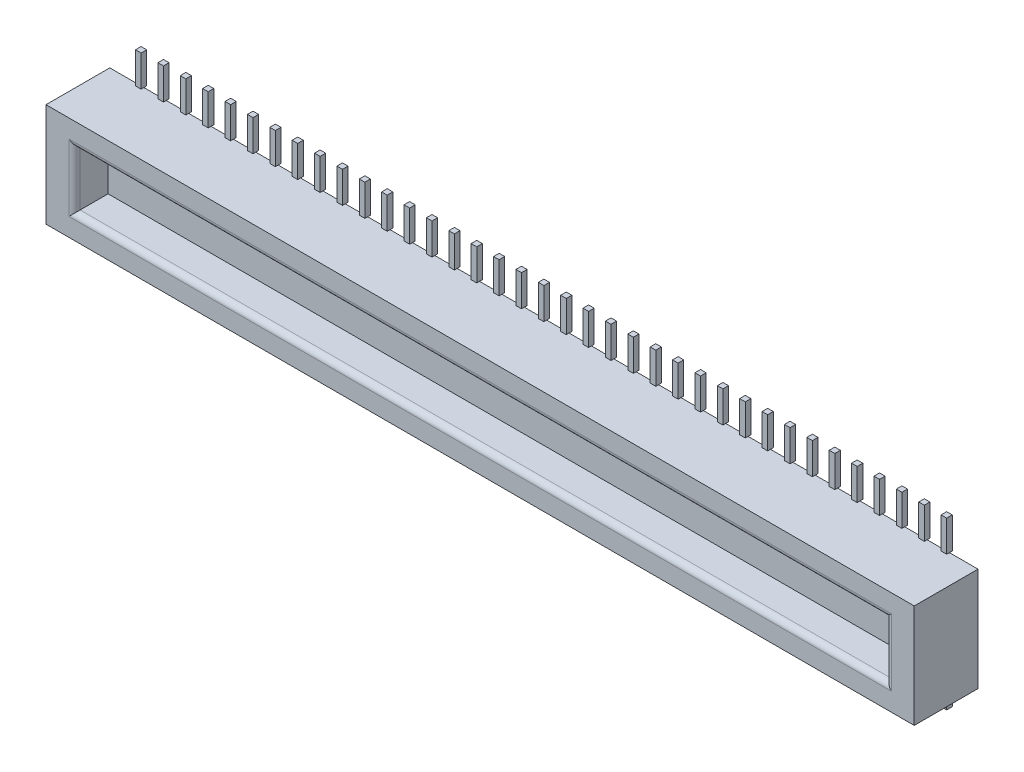
from build123d import *

# Parameters (mm, degrees)
SKETCH1_W                = 15.52
SKETCH1_H                = 1.85
BOSS_EXTRUDE1_DEPTH      = 1.14
SKETCH2_W                = 14.5
SKETCH2_H                = 1
CUT_EXTRUDE1_DEPTH       = 0.6
SKETCH3_W                = 0.1
SKETCH3_H                = 0.1
BOSS_EXTRUDE2_DEPTH      = 0.56
LPATTERN1_COUNT          = 19
LPATTERN1_PITCH          = 0.4
LPATTERN1_COL_COUNT      = 19
LPATTERN1_COL_PITCH      = 0.4
MIRROR1_COPY_1_SKETCH_W  = 0.1
MIRROR1_COPY_1_SKETCH_H  = 0.1
MIRROR1_COPY_1_DEPTH     = 0.56
MIRROR1_COPY_2_SKETCH_W  = 0.1
MIRROR1_COPY_2_SKETCH_H  = 0.1
MIRROR1_COPY_2_DEPTH     = 0.56
MIRROR1_COPY_3_SKETCH_W  = 0.1
MIRROR1_COPY_3_SKETCH_H  = 0.1
MIRROR1_COPY_3_DEPTH     = 0.56
MIRROR1_COPY_4_SKETCH_W  = 0.1
MIRROR1_COPY_4_SKETCH_H  = 0.1
MIRROR1_COPY_4_DEPTH     = 0.56
MIRROR1_COPY_5_SKETCH_W  = 0.1
MIRROR1_COPY_5_SKETCH_H  = 0.1
MIRROR1_COPY_5_DEPTH     = 0.56
MIRROR1_COPY_6_SKETCH_W  = 0.1
MIRROR1_COPY_6_SKETCH_H  = 0.1
MIRROR1_COPY_6_DEPTH     = 0.56
MIRROR1_COPY_7_SKETCH_W  = 0.1
MIRROR1_COPY_7_SKETCH_H  = 0.1
MIRROR1_COPY_7_DEPTH     = 0.56
MIRROR1_COPY_8_SKETCH_W  = 0.1
MIRROR1_COPY_8_SKETCH_H  = 0.1
MIRROR1_COPY_8_DEPTH     = 0.56
MIRROR1_COPY_9_SKETCH_W  = 0.1
MIRROR1_COPY_9_SKETCH_H  = 0.1
MIRROR1_COPY_9_DEPTH     = 0.56
MIRROR1_COPY_10_SKETCH_W = 0.1
MIRROR1_COPY_10_SKETCH_H = 0.1
MIRROR1_COPY_10_DEPTH    = 0.56
MIRROR1_COPY_11_SKETCH_W = 0.1
MIRROR1_COPY_11_SKETCH_H = 0.1
MIRROR1_COPY_11_DEPTH    = 0.56
MIRROR1_COPY_12_SKETCH_W = 0.1
MIRROR1_COPY_12_SKETCH_H = 0.1
MIRROR1_COPY_12_DEPTH    = 0.56
MIRROR1_COPY_13_SKETCH_W = 0.1
MIRROR1_COPY_13_SKETCH_H = 0.1
MIRROR1_COPY_13_DEPTH    = 0.56
MIRROR1_COPY_14_SKETCH_W = 0.1
MIRROR1_COPY_14_SKETCH_H = 0.1
MIRROR1_COPY_14_DEPTH    = 0.56
MIRROR1_COPY_15_SKETCH_W = 0.1
MIRROR1_COPY_15_SKETCH_H = 0.1
MIRROR1_COPY_15_DEPTH    = 0.56
MIRROR1_COPY_16_SKETCH_W = 0.1
MIRROR1_COPY_16_SKETCH_H = 0.1
MIRROR1_COPY_16_DEPTH    = 0.56
MIRROR1_COPY_17_SKETCH_W = 0.1
MIRROR1_COPY_17_SKETCH_H = 0.1
MIRROR1_COPY_17_DEPTH    = 0.56
MIRROR1_COPY_18_SKETCH_W = 0.1
MIRROR1_COPY_18_SKETCH_H = 0.1
MIRROR1_COPY_18_DEPTH    = 0.56
MIRROR1_COPY_19_SKETCH_W = 0.1
MIRROR1_COPY_19_SKETCH_H = 0.1
MIRROR1_COPY_19_DEPTH    = 0.56
MIRROR1_COPY_20_SKETCH_W = 0.1
MIRROR1_COPY_20_SKETCH_H = 0.1
MIRROR1_COPY_20_DEPTH    = 0.56
MIRROR1_COPY_21_SKETCH_W = 0.1
MIRROR1_COPY_21_SKETCH_H = 0.1
MIRROR1_COPY_21_DEPTH    = 0.56
MIRROR1_COPY_22_SKETCH_W = 0.1
MIRROR1_COPY_22_SKETCH_H = 0.1
MIRROR1_COPY_22_DEPTH    = 0.56
MIRROR1_COPY_23_SKETCH_W = 0.1
MIRROR1_COPY_23_SKETCH_H = 0.1
MIRROR1_COPY_23_DEPTH    = 0.56
MIRROR1_COPY_24_SKETCH_W = 0.1
MIRROR1_COPY_24_SKETCH_H = 0.1
MIRROR1_COPY_24_DEPTH    = 0.56
MIRROR1_COPY_25_SKETCH_W = 0.1
MIRROR1_COPY_25_SKETCH_H = 0.1
MIRROR1_COPY_25_DEPTH    = 0.56
MIRROR1_COPY_26_SKETCH_W = 0.1
MIRROR1_COPY_26_SKETCH_H = 0.1
MIRROR1_COPY_26_DEPTH    = 0.56
MIRROR1_COPY_27_SKETCH_W = 0.1
MIRROR1_COPY_27_SKETCH_H = 0.1
MIRROR1_COPY_27_DEPTH    = 0.56
MIRROR1_COPY_28_SKETCH_W = 0.1
MIRROR1_COPY_28_SKETCH_H = 0.1
MIRROR1_COPY_28_DEPTH    = 0.56
MIRROR1_COPY_29_SKETCH_W = 0.1
MIRROR1_COPY_29_SKETCH_H = 0.1
MIRROR1_COPY_29_DEPTH    = 0.56
MIRROR1_COPY_30_SKETCH_W = 0.1
MIRROR1_COPY_30_SKETCH_H = 0.1
MIRROR1_COPY_30_DEPTH    = 0.56
MIRROR1_COPY_31_SKETCH_W = 0.1
MIRROR1_COPY_31_SKETCH_H = 0.1
MIRROR1_COPY_31_DEPTH    = 0.56
MIRROR1_COPY_32_SKETCH_W = 0.1
MIRROR1_COPY_32_SKETCH_H = 0.1
MIRROR1_COPY_32_DEPTH    = 0.56
MIRROR1_COPY_33_SKETCH_W = 0.1
MIRROR1_COPY_33_SKETCH_H = 0.1
MIRROR1_COPY_33_DEPTH    = 0.56
MIRROR1_COPY_34_SKETCH_W = 0.1
MIRROR1_COPY_34_SKETCH_H = 0.1
MIRROR1_COPY_34_DEPTH    = 0.56
MIRROR1_COPY_35_SKETCH_W = 0.1
MIRROR1_COPY_35_SKETCH_H = 0.1
MIRROR1_COPY_35_DEPTH    = 0.56
MIRROR1_COPY_36_SKETCH_W = 0.1
MIRROR1_COPY_36_SKETCH_H = 0.1
MIRROR1_COPY_36_DEPTH    = 0.56
FILLET1_R                = 0.1


with BuildPart() as part:
    # Sketch1 → Boss-Extrude1 (new body)
    with BuildSketch(Plane.XY):
        Rectangle(SKETCH1_W, SKETCH1_H)
    extrude(amount=BOSS_EXTRUDE1_DEPTH)

    # Sketch2 → Cut-Extrude1 (cut)
    with BuildSketch(Plane.XY.offset(1.14)):
        Rectangle(SKETCH2_W, SKETCH2_H)
    extrude(amount=-CUT_EXTRUDE1_DEPTH, mode=Mode.SUBTRACT)

    # Sketch3 → Boss-Extrude2 (add)
    with BuildSketch(Plane.XZ.offset(0.925)):
        Rectangle(SKETCH3_W, SKETCH3_H)
    boss_extrude2 = extrude(amount=BOSS_EXTRUDE2_DEPTH)

    # LPattern1: Boss-Extrude2 ×19
    with Locations(*[(-i * LPATTERN1_PITCH, 0, 0) for i in range(1, LPATTERN1_COUNT)]):
        add(boss_extrude2)

    # LPattern1 col: Boss-Extrude2 ×19
    with Locations(*[(i * LPATTERN1_COL_PITCH, 0, 0) for i in range(1, LPATTERN1_COL_COUNT)]):
        add(boss_extrude2)

    # Mirror1: Boss-Extrude2 across plane
    add(boss_extrude2.mirror(Plane.ZX))

    # Mirror1 copy 1 sketch → Mirror1 copy 1 (add)
    with BuildSketch(Plane(origin=(-0.4, 0.925, 0), x_dir=(1, 0, 0), z_dir=(0, 1, 0))):
        Rectangle(MIRROR1_COPY_1_SKETCH_W, MIRROR1_COPY_1_SKETCH_H)
    extrude(amount=MIRROR1_COPY_1_DEPTH)

    # Mirror1 copy 2 sketch → Mirror1 copy 2 (add)
    with BuildSketch(Plane(origin=(-0.8, 0.925, 0), x_dir=(1, 0, 0), z_dir=(0, 1, 0))):
        Rectangle(MIRROR1_COPY_2_SKETCH_W, MIRROR1_COPY_2_SKETCH_H)
    extrude(amount=MIRROR1_COPY_2_DEPTH)

    # Mirror1 copy 3 sketch → Mirror1 copy 3 (add)
    with BuildSketch(Plane(origin=(-1.2, 0.925, 0), x_dir=(1, 0, 0), z_dir=(0, 1, 0))):
        Rectangle(MIRROR1_COPY_3_SKETCH_W, MIRROR1_COPY_3_SKETCH_H)
    extrude(amount=MIRROR1_COPY_3_DEPTH)

    # Mirror1 copy 4 sketch → Mirror1 copy 4 (add)
    with BuildSketch(Plane(origin=(-1.6, 0.925, 0), x_dir=(1, 0, 0), z_dir=(0, 1, 0))):
        Rectangle(MIRROR1_COPY_4_SKETCH_W, MIRROR1_COPY_4_SKETCH_H)
    extrude(amount=MIRROR1_COPY_4_DEPTH)

    # Mirror1 copy 5 sketch → Mirror1 copy 5 (add)
    with BuildSketch(Plane(origin=(-2, 0.925, 0), x_dir=(1, 0, 0), z_dir=(0, 1, 0))):
        Rectangle(MIRROR1_COPY_5_SKETCH_W, MIRROR1_COPY_5_SKETCH_H)
    extrude(amount=MIRROR1_COPY_5_DEPTH)

    # Mirror1 copy 6 sketch → Mirror1 copy 6 (add)
    with BuildSketch(Plane(origin=(-2.4, 0.925, 0), x_dir=(1, 0, 0), z_dir=(0, 1, 0))):
        Rectangle(MIRROR1_COPY_6_SKETCH_W, MIRROR1_COPY_6_SKETCH_H)
    extrude(amount=MIRROR1_COPY_6_DEPTH)

    # Mirror1 copy 7 sketch → Mirror1 copy 7 (add)
    with BuildSketch(Plane(origin=(-2.8, 0.925, 0), x_dir=(1, 0, 0), z_dir=(0, 1, 0))):
        Rectangle(MIRROR1_COPY_7_SKETCH_W, MIRROR1_COPY_7_SKETCH_H)
    extrude(amount=MIRROR1_COPY_7_DEPTH)

    # Mirror1 copy 8 sketch → Mirror1 copy 8 (add)
    with BuildSketch(Plane(origin=(-3.2, 0.925, 0), x_dir=(1, 0, 0), z_dir=(0, 1, 0))):
        Rectangle(MIRROR1_COPY_8_SKETCH_W, MIRROR1_COPY_8_SKETCH_H)
    extrude(amount=MIRROR1_COPY_8_DEPTH)

    # Mirror1 copy 9 sketch → Mirror1 copy 9 (add)
    with BuildSketch(Plane(origin=(-3.6, 0.925, 0), x_dir=(1, 0, 0), z_dir=(0, 1, 0))):
        Rectangle(MIRROR1_COPY_9_SKETCH_W, MIRROR1_COPY_9_SKETCH_H)
    extrude(amount=MIRROR1_COPY_9_DEPTH)

    # Mirror1 copy 10 sketch → Mirror1 copy 10 (add)
    with BuildSketch(Plane(origin=(-4, 0.925, 0), x_dir=(1, 0, 0), z_dir=(0, 1, 0))):
        Rectangle(MIRROR1_COPY_10_SKETCH_W, MIRROR1_COPY_10_SKETCH_H)
    extrude(amount=MIRROR1_COPY_10_DEPTH)

    # Mirror1 copy 11 sketch → Mirror1 copy 11 (add)
    with BuildSketch(Plane(origin=(-4.4, 0.925, 0), x_dir=(1, 0, 0), z_dir=(0, 1, 0))):
        Rectangle(MIRROR1_COPY_11_SKETCH_W, MIRROR1_COPY_11_SKETCH_H)
    extrude(amount=MIRROR1_COPY_11_DEPTH)

    # Mirror1 copy 12 sketch → Mirror1 copy 12 (add)
    with BuildSketch(Plane(origin=(-4.8, 0.925, 0), x_dir=(1, 0, 0), z_dir=(0, 1, 0))):
        Rectangle(MIRROR1_COPY_12_SKETCH_W, MIRROR1_COPY_12_SKETCH_H)
    extrude(amount=MIRROR1_COPY_12_DEPTH)

    # Mirror1 copy 13 sketch → Mirror1 copy 13 (add)
    with BuildSketch(Plane(origin=(-5.2, 0.925, 0), x_dir=(1, 0, 0), z_dir=(0, 1, 0))):
        Rectangle(MIRROR1_COPY_13_SKETCH_W, MIRROR1_COPY_13_SKETCH_H)
    extrude(amount=MIRROR1_COPY_13_DEPTH)

    # Mirror1 copy 14 sketch → Mirror1 copy 14 (add)
    with BuildSketch(Plane(origin=(-5.6, 0.925, 0), x_dir=(1, 0, 0), z_dir=(0, 1, 0))):
        Rectangle(MIRROR1_COPY_14_SKETCH_W, MIRROR1_COPY_14_SKETCH_H)
    extrude(amount=MIRROR1_COPY_14_DEPTH)

    # Mirror1 copy 15 sketch → Mirror1 copy 15 (add)
    with BuildSketch(Plane(origin=(-6, 0.925, 0), x_dir=(1, 0, 0), z_dir=(0, 1, 0))):
        Rectangle(MIRROR1_COPY_15_SKETCH_W, MIRROR1_COPY_15_SKETCH_H)
    extrude(amount=MIRROR1_COPY_15_DEPTH)

    # Mirror1 copy 16 sketch → Mirror1 copy 16 (add)
    with BuildSketch(Plane(origin=(-6.4, 0.925, 0), x_dir=(1, 0, 0), z_dir=(0, 1, 0))):
        Rectangle(MIRROR1_COPY_16_SKETCH_W, MIRROR1_COPY_16_SKETCH_H)
    extrude(amount=MIRROR1_COPY_16_DEPTH)

    # Mirror1 copy 17 sketch → Mirror1 copy 17 (add)
    with BuildSketch(Plane(origin=(-6.8, 0.925, 0), x_dir=(1, 0, 0), z_dir=(0, 1, 0))):
        Rectangle(MIRROR1_COPY_17_SKETCH_W, MIRROR1_COPY_17_SKETCH_H)
    extrude(amount=MIRROR1_COPY_17_DEPTH)

    # Mirror1 copy 18 sketch → Mirror1 copy 18 (add)
    with BuildSketch(Plane(origin=(-7.2, 0.925, 0), x_dir=(1, 0, 0), z_dir=(0, 1, 0))):
        Rectangle(MIRROR1_COPY_18_SKETCH_W, MIRROR1_COPY_18_SKETCH_H)
    extrude(amount=MIRROR1_COPY_18_DEPTH)

    # Mirror1 copy 19 sketch → Mirror1 copy 19 (add)
    with BuildSketch(Plane(origin=(0.4, 0.925, 0), x_dir=(1, 0, 0), z_dir=(0, 1, 0))):
        Rectangle(MIRROR1_COPY_19_SKETCH_W, MIRROR1_COPY_19_SKETCH_H)
    extrude(amount=MIRROR1_COPY_19_DEPTH)

    # Mirror1 copy 20 sketch → Mirror1 copy 20 (add)
    with BuildSketch(Plane(origin=(0.8, 0.925, 0), x_dir=(1, 0, 0), z_dir=(0, 1, 0))):
        Rectangle(MIRROR1_COPY_20_SKETCH_W, MIRROR1_COPY_20_SKETCH_H)
    extrude(amount=MIRROR1_COPY_20_DEPTH)

    # Mirror1 copy 21 sketch → Mirror1 copy 21 (add)
    with BuildSketch(Plane(origin=(1.2, 0.925, 0), x_dir=(1, 0, 0), z_dir=(0, 1, 0))):
        Rectangle(MIRROR1_COPY_21_SKETCH_W, MIRROR1_COPY_21_SKETCH_H)
    extrude(amount=MIRROR1_COPY_21_DEPTH)

    # Mirror1 copy 22 sketch → Mirror1 copy 22 (add)
    with BuildSketch(Plane(origin=(1.6, 0.925, 0), x_dir=(1, 0, 0), z_dir=(0, 1, 0))):
        Rectangle(MIRROR1_COPY_22_SKETCH_W, MIRROR1_COPY_22_SKETCH_H)
    extrude(amount=MIRROR1_COPY_22_DEPTH)

    # Mirror1 copy 23 sketch → Mirror1 copy 23 (add)
    with BuildSketch(Plane(origin=(2, 0.925, 0), x_dir=(1, 0, 0), z_dir=(0, 1, 0))):
        Rectangle(MIRROR1_COPY_23_SKETCH_W, MIRROR1_COPY_23_SKETCH_H)
    extrude(amount=MIRROR1_COPY_23_DEPTH)

    # Mirror1 copy 24 sketch → Mirror1 copy 24 (add)
    with BuildSketch(Plane(origin=(2.4, 0.925, 0), x_dir=(1, 0, 0), z_dir=(0, 1, 0))):
        Rectangle(MIRROR1_COPY_24_SKETCH_W, MIRROR1_COPY_24_SKETCH_H)
    extrude(amount=MIRROR1_COPY_24_DEPTH)

    # Mirror1 copy 25 sketch → Mirror1 copy 25 (add)
    with BuildSketch(Plane(origin=(2.8, 0.925, 0), x_dir=(1, 0, 0), z_dir=(0, 1, 0))):
        Rectangle(MIRROR1_COPY_25_SKETCH_W, MIRROR1_COPY_25_SKETCH_H)
    extrude(amount=MIRROR1_COPY_25_DEPTH)

    # Mirror1 copy 26 sketch → Mirror1 copy 26 (add)
    with BuildSketch(Plane(origin=(3.2, 0.925, 0), x_dir=(1, 0, 0), z_dir=(0, 1, 0))):
        Rectangle(MIRROR1_COPY_26_SKETCH_W, MIRROR1_COPY_26_SKETCH_H)
    extrude(amount=MIRROR1_COPY_26_DEPTH)

    # Mirror1 copy 27 sketch → Mirror1 copy 27 (add)
    with BuildSketch(Plane(origin=(3.6, 0.925, 0), x_dir=(1, 0, 0), z_dir=(0, 1, 0))):
        Rectangle(MIRROR1_COPY_27_SKETCH_W, MIRROR1_COPY_27_SKETCH_H)
    extrude(amount=MIRROR1_COPY_27_DEPTH)

    # Mirror1 copy 28 sketch → Mirror1 copy 28 (add)
    with BuildSketch(Plane(origin=(4, 0.925, 0), x_dir=(1, 0, 0), z_dir=(0, 1, 0))):
        Rectangle(MIRROR1_COPY_28_SKETCH_W, MIRROR1_COPY_28_SKETCH_H)
    extrude(amount=MIRROR1_COPY_28_DEPTH)

    # Mirror1 copy 29 sketch → Mirror1 copy 29 (add)
    with BuildSketch(Plane(origin=(4.4, 0.925, 0), x_dir=(1, 0, 0), z_dir=(0, 1, 0))):
        Rectangle(MIRROR1_COPY_29_SKETCH_W, MIRROR1_COPY_29_SKETCH_H)
    extrude(amount=MIRROR1_COPY_29_DEPTH)

    # Mirror1 copy 30 sketch → Mirror1 copy 30 (add)
    with BuildSketch(Plane(origin=(4.8, 0.925, 0), x_dir=(1, 0, 0), z_dir=(0, 1, 0))):
        Rectangle(MIRROR1_COPY_30_SKETCH_W, MIRROR1_COPY_30_SKETCH_H)
    extrude(amount=MIRROR1_COPY_30_DEPTH)

    # Mirror1 copy 31 sketch → Mirror1 copy 31 (add)
    with BuildSketch(Plane(origin=(5.2, 0.925, 0), x_dir=(1, 0, 0), z_dir=(0, 1, 0))):
        Rectangle(MIRROR1_COPY_31_SKETCH_W, MIRROR1_COPY_31_SKETCH_H)
    extrude(amount=MIRROR1_COPY_31_DEPTH)

    # Mirror1 copy 32 sketch → Mirror1 copy 32 (add)
    with BuildSketch(Plane(origin=(5.6, 0.925, 0), x_dir=(1, 0, 0), z_dir=(0, 1, 0))):
        Rectangle(MIRROR1_COPY_32_SKETCH_W, MIRROR1_COPY_32_SKETCH_H)
    extrude(amount=MIRROR1_COPY_32_DEPTH)

    # Mirror1 copy 33 sketch → Mirror1 copy 33 (add)
    with BuildSketch(Plane(origin=(6, 0.925, 0), x_dir=(1, 0, 0), z_dir=(0, 1, 0))):
        Rectangle(MIRROR1_COPY_33_SKETCH_W, MIRROR1_COPY_33_SKETCH_H)
    extrude(amount=MIRROR1_COPY_33_DEPTH)

    # Mirror1 copy 34 sketch → Mirror1 copy 34 (add)
    with BuildSketch(Plane(origin=(6.4, 0.925, 0), x_dir=(1, 0, 0), z_dir=(0, 1, 0))):
        Rectangle(MIRROR1_COPY_34_SKETCH_W, MIRROR1_COPY_34_SKETCH_H)
    extrude(amount=MIRROR1_COPY_34_DEPTH)

    # Mirror1 copy 35 sketch → Mirror1 copy 35 (add)
    with BuildSketch(Plane(origin=(6.8, 0.925, 0), x_dir=(1, 0, 0), z_dir=(0, 1, 0))):
        Rectangle(MIRROR1_COPY_35_SKETCH_W, MIRROR1_COPY_35_SKETCH_H)
    extrude(amount=MIRROR1_COPY_35_DEPTH)

    # Mirror1 copy 36 sketch → Mirror1 copy 36 (add)
    with BuildSketch(Plane(origin=(7.2, 0.925, 0), x_dir=(1, 0, 0), z_dir=(0, 1, 0))):
        Rectangle(MIRROR1_COPY_36_SKETCH_W, MIRROR1_COPY_36_SKETCH_H)
    extrude(amount=MIRROR1_COPY_36_DEPTH)

    # Fillet1
    fillet1_edges = [part.edges().sort_by_distance(p)[0] for p in [
        (7.25, 0, 1.14),
        (0, 0.5, 1.14),
        (-7.25, 0, 1.14),
        (0, -0.5, 1.14),
    ]]
    fillet(fillet1_edges, radius=FILLET1_R)


solid = part.part
